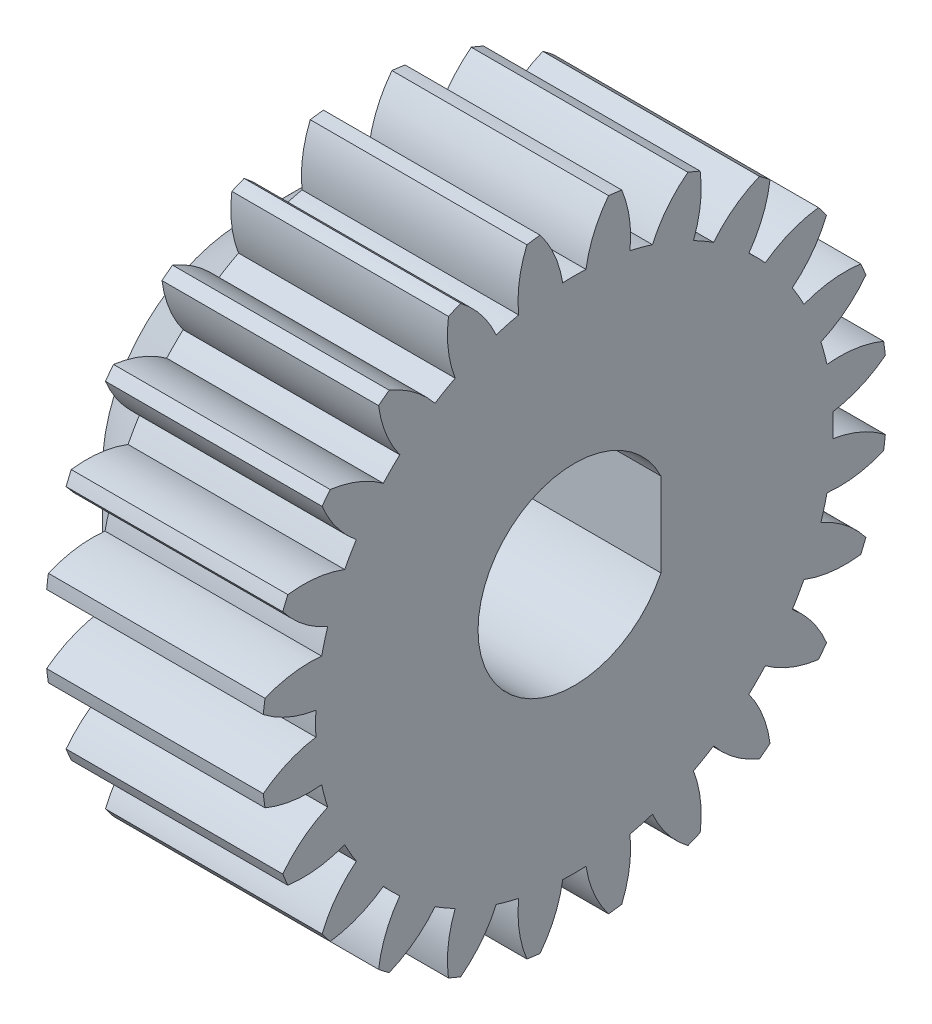
from build123d import *

# Parameters (mm, degrees)
BASPROSKE_W         = 4.5
BASPROSKE_H         = 6.5
TOOTHCUT_DEPTH      = 11.234744745
TEETHCUTS_COUNT     = 24
TEETHCUTS_ANGLE     = 345
BORSKE_R            = 1.5
BORE_DEPTH          = 50.0000508
CUT_EXTRUDE_1_REACH = 13.408


with BuildPart() as part:
    # BasProSke → Base-Revolve (revolve)
    with BuildSketch(Plane(origin=(0, 0, 0), x_dir=(1, 0, 0), z_dir=(0, 1, 0)), mode=Mode.PRIVATE) as base_revolve_sk:
        with Locations((2.25, 3.25)):
            Rectangle(BASPROSKE_W, BASPROSKE_H)
    revolve(base_revolve_sk.sketch.rotate(Axis((-10, 0, 0), (1, 0, 0)), 180), axis=Axis((-10, 0, 0), (1, 0, 0)))

    # TooCutSke → ToothCut (cut, through all)
    with BuildSketch(Plane(origin=(0, 0, 0), x_dir=(0, 0, -1), z_dir=(1, 0, 0))):
        with BuildLine():
            ThreePointArc((0.241646108, 5.368564348), (0, 5.374), (-0.241646108, 5.368564348))
            ThreePointArc((-0.241646108, 5.368564348), (-0.413699957, 5.957993365), (-0.729686037, 6.48447403))
            ThreePointArc((-0.729686037, 6.48447403), (0, 6.5254), (0.729686037, 6.48447403))
            ThreePointArc((0.729686037, 6.48447403), (0.413699957, 5.957993365), (0.241646108, 5.368564348))
        make_face()
    toothcut = extrude(amount=TOOTHCUT_DEPTH, mode=Mode.SUBTRACT)

    # TeethCuts: ToothCut ×24 about axis
    teethcuts_axis = Axis((-10, 0, 0), (1, 0, 0))
    for i in range(1, TEETHCUTS_COUNT):
        add(toothcut.rotate(teethcuts_axis, i * TEETHCUTS_ANGLE / (TEETHCUTS_COUNT - 1)), mode=Mode.SUBTRACT)

    # BorSke → Bore (cut, symmetric)
    with BuildSketch(Plane(origin=(0, 0, 0), x_dir=(0, 0, -1), z_dir=(1, 0, 0))):
        with Locations(Location((0, 0, 0), (0, 0, 180))):
            Circle(BORSKE_R)
    extrude(amount=BORE_DEPTH, both=True, mode=Mode.SUBTRACT)

    # 草图1 → 旋转1 (revolve)
    with BuildSketch(Plane(origin=(0, 0, 0), x_dir=(1, 0, 0), z_dir=(0, 1, 0))):
        Polygon((0, 0), (-2.33, 0), (-2.33, 2.97), (0, 5.3), align=None)
    revolve(axis=Axis((0, 0, 0), (-1, 0, 0)))

    # 草图2 → 切除-拉伸1 (cut, up to next)
    with BuildSketch(Plane(origin=(4.5, 0, 0), x_dir=(0, 0, -1), z_dir=(1, 0, 0)), mode=Mode.PRIVATE) as cut_extrude_1_sk1:
        with BuildLine():
            Line((1.8, -0.871779789), (1.8, 0.871779789))
            ThreePointArc((1.8, 0.871779789), (-2, 0), (1.8, -0.871779789))
        make_face()
    cut_extrude_1_tool1 = extrude(cut_extrude_1_sk1.sketch, amount=-CUT_EXTRUDE_1_REACH, mode=Mode.PRIVATE) & part.part
    add(cut_extrude_1_tool1.solids().sort_by_distance((4.5, 0, 0.035819))[0], mode=Mode.SUBTRACT)


solid = part.part
